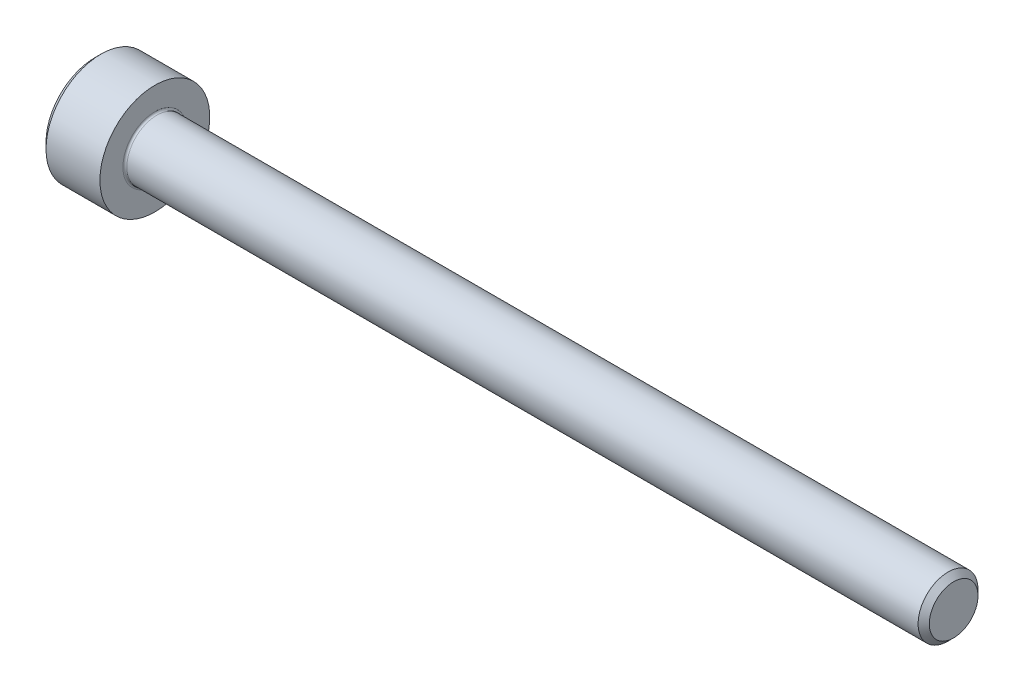
from build123d import *

# Parameters (mm, degrees)
FILLET1_R   = 0.1
HEX_2_DEPTH = 1.3


with BuildPart() as part:
    # BodySke → Base-Revolve (revolve)
    with BuildSketch(Plane.XY):
        Polygon((0, 0), (0, 2.45), (0.3, 2.75), (3, 2.75), (3, 1.5), (42.7195, 1.5), (43, 1.2195), (43, 0), align=None)
    revolve(axis=Axis((-31.75, 0, 0), (1, 0, 0)))

    # Fillet1
    fillet1_edges = [part.edges().sort_by_distance(p)[0] for p in [
        (3, -1.5, 0),
    ]]
    fillet(fillet1_edges, radius=FILLET1_R)

    # Sketch2 → Hex-PreBroach (revolve, cut)
    with BuildSketch(Plane.XY):
        Polygon((0, 1.28), (1.3, 1.28), (2.039008345, 0), (0, 0), align=None)
    revolve(axis=Axis((0, 0, 0), (1, 0, 0)), mode=Mode.SUBTRACT)

    # Sketch3 → Hex 2 (cut)
    with BuildSketch(Plane(origin=(0, 0, 0), x_dir=(0, 0.500000000000001, 0.866025403784438), z_dir=(-1, 0, 0))):
        Polygon((0.739008345, 1.28), (-0.739008345, 1.28), (-1.478016689, 0), (-0.739008345, -1.28), (0.739008345, -1.28), (1.478016689, 0), align=None)
    extrude(amount=-HEX_2_DEPTH, mode=Mode.SUBTRACT)


solid = part.part
